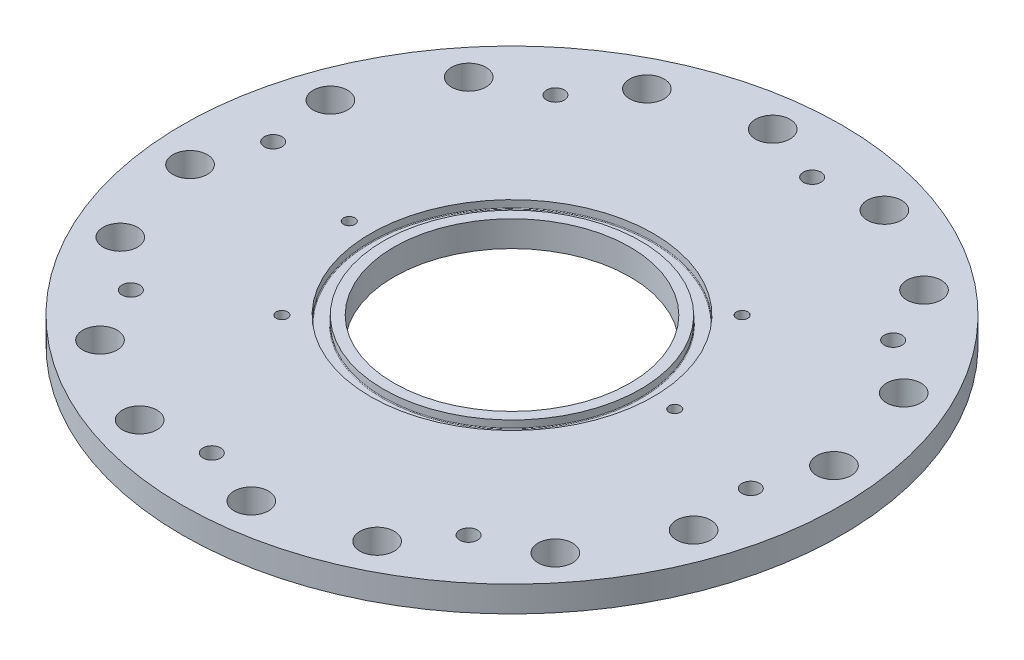
from build123d import *

# Parameters (mm, degrees)
SKETCH1_R                            = 121.5
SKETCH1_R_2                          = 43.5
BOSS_EXTRUDE1_DEPTH                  = 9.525
CUT_EXTRUDE1_START                   = 9.525
SKETCH1_4_R                          = 52.1208
SKETCH1_4_R_2                        = 47.371
CUT_EXTRUDE1_DEPTH                   = 2.8448
CIRPATTERN1_COUNT                    = 16
SKETCH5_R                            = 6.35
CUBE_5_16_CLEARANCE_THRU_HOLES_DEPTH = 173.090748226
F_5_16_18_TAPPED_HOLE1_D             = 6.5278
CIRPATTERN3_COUNT                    = 8
BOTTOM_ISO160_R                      = 76.5
BOTTOM_ISO160_R_2                    = 70.1548
CUT_EXTRUDE3_DEPTH                   = 2.79
FILLET1_R                            = 0.254


with BuildPart() as part:
    # Sketch1 → Boss-Extrude1 (new body)
    with BuildSketch(Plane(origin=(0, 0, 0), x_dir=(1, 0, 0), z_dir=(0, 1, 0))):
        with Locations(Location((0, 0, 0), (0, 0, 90))):
            Circle(SKETCH1_R)
        with Locations(Location((0, 0, 0), (0, 0, 90))):
            Circle(SKETCH1_R_2, mode=Mode.SUBTRACT)
    extrude(amount=BOSS_EXTRUDE1_DEPTH)

    # Sketch1<4> → Cut-Extrude1 (cut)
    with BuildSketch(Plane(origin=(0, 0, 0), x_dir=(1, 0, 0), z_dir=(0, 1, 0)).offset(CUT_EXTRUDE1_START)):
        with Locations(Location((0, 0, 0), (0, 0, 270))):
            Circle(SKETCH1_4_R)
        with Locations(Location((0, 0, 0), (0, 0, 270))):
            Circle(SKETCH1_4_R_2, mode=Mode.SUBTRACT)
    extrude(amount=-CUT_EXTRUDE1_DEPTH, mode=Mode.SUBTRACT)

    # Sketch4 → M5x0.8 Tapped Hole2 (revolve, cut)
    with BuildSketch(Plane(origin=(60, 9.525, 0), x_dir=(0, 0, 1), z_dir=(1, 0, 0))):
        Polygon((0, 0), (0, 7), (2.1, 5.7381927), (2.1, 0), align=None)
    m5x0_8_tapped_hole2 = revolve(axis=Axis((60, 15.875, 0), (0, -1, 0)), mode=Mode.SUBTRACT)

    # CirPattern1: M5x0.8 Tapped Hole2 ×16 about axis, 12 skipped
    cirpattern1_axis = Axis((0, 9.525, 0), (0, -1, 0))
    add([m5x0_8_tapped_hole2.rotate(cirpattern1_axis, i * 360 / CIRPATTERN1_COUNT) for i in range(1, CIRPATTERN1_COUNT) if i not in (1, 2, 3, 4, 5, 7, 9, 10, 11, 12, 13, 15)], mode=Mode.SUBTRACT)

    # Sketch5 → Cube_5/16_Clearance_Thru Holes (cut, through all)
    with BuildSketch(Plane(origin=(0, 0, 0), x_dir=(1, 0, 0), z_dir=(0, 1, 0))):
        with Locations(Location((11.289074033, -107.4083647, 0), (0, 0, 270))):
            Circle(SKETCH5_R)
        with Locations(Location((47.344083853, -97.069757, 0), (0, 0, 270))):
            Circle(SKETCH5_R)
        with Locations(Location((-67.966602233, -83.931763837, 0), (0, 0, 270))):
            Circle(SKETCH5_R)
        with Locations(Location((-35.161360681, -102.116006165, 0), (0, 0, 270))):
            Circle(SKETCH5_R)
        with Locations(Location((-107.4083647, -11.289074033, 0), (0, 0, 270))):
            Circle(SKETCH5_R)
        with Locations(Location((-97.069757, -47.344083853, 0), (0, 0, 270))):
            Circle(SKETCH5_R)
        with Locations(Location((-83.931763837, 67.966602233, 0), (0, 0, 270))):
            Circle(SKETCH5_R)
        with Locations(Location((-102.116006165, 35.161360681, 0), (0, 0, 270))):
            Circle(SKETCH5_R)
        with Locations(Location((-11.289074033, 107.4083647, 0), (0, 0, 270))):
            Circle(SKETCH5_R)
        with Locations(Location((-47.344083853, 97.069757, 0), (0, 0, 270))):
            Circle(SKETCH5_R)
        with Locations(Location((67.966602233, 83.931763837, 0), (0, 0, 270))):
            Circle(SKETCH5_R)
        with Locations(Location((35.161360681, 102.116006165, 0), (0, 0, 270))):
            Circle(SKETCH5_R)
        with Locations(Location((107.4083647, 11.289074033, 0), (0, 0, 270))):
            Circle(SKETCH5_R)
        with Locations(Location((97.069757, 47.344083853, 0), (0, 0, 270))):
            Circle(SKETCH5_R)
        with Locations(Location((83.931763837, -67.966602233, 0), (0, 0, 270))):
            Circle(SKETCH5_R)
        with Locations(Location((102.116006165, -35.161360681, 0), (0, 0, 270))):
            Circle(SKETCH5_R)
    extrude(amount=CUBE_5_16_CLEARANCE_THRU_HOLES_DEPTH, mode=Mode.SUBTRACT)

    # 5/16-18 Tapped Hole1 (through all)
    with Locations(Plane(origin=(-62.251463664, 0, -78.260815685), x_dir=(0, 0, -1), z_dir=(0, -1, 0))):
        with Locations((0, 0)):
            f_5_16_18_tapped_hole1 = Hole(F_5_16_18_TAPPED_HOLE1_D / 2)

    # CirPattern3: 5/16-18 Tapped Hole1 ×8 about axis
    cirpattern3_axis = Axis((0, 0, 0), (0, 1, 0))
    for i in range(1, CIRPATTERN3_COUNT):
        add(f_5_16_18_tapped_hole1.rotate(cirpattern3_axis, i * 360 / CIRPATTERN3_COUNT), mode=Mode.SUBTRACT)

    # Bottom_Iso160 → Cut-Extrude3 (cut)
    with BuildSketch(Plane(origin=(0, 0, 0), x_dir=(1, 0, 0), z_dir=(0, 1, 0))):
        with Locations(Location((0, 0, 0), (0, 0, 270))):
            Circle(BOTTOM_ISO160_R)
        with Locations(Location((0, 0, 0), (0, 0, 270))):
            Circle(BOTTOM_ISO160_R_2, mode=Mode.SUBTRACT)
    extrude(amount=CUT_EXTRUDE3_DEPTH, mode=Mode.SUBTRACT)

    # Fillet1
    fillet1_edges = [part.edges().sort_by_distance(p)[0] for p in [
        (0, 6.6802, -52.1208),
        (0, 6.6802, -47.371),
    ]]
    fillet(fillet1_edges, radius=FILLET1_R)


solid = part.part
